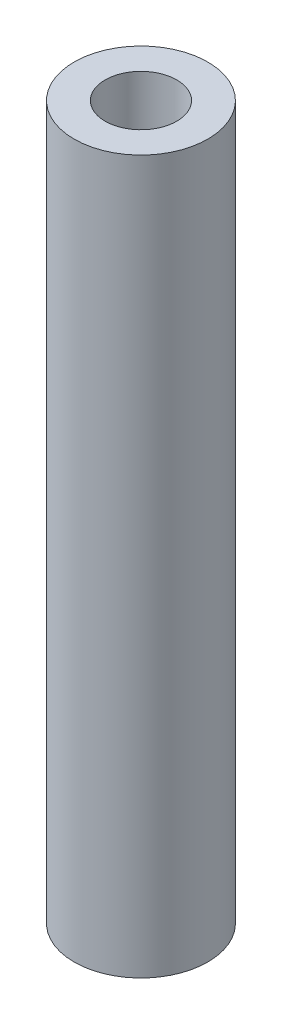
from build123d import *

# Parameters (mm, degrees)
SKETCH1_R           = 4.7625
SKETCH1_R_2         = 2.5527
BOSS_EXTRUDE1_DEPTH = 25.4


with BuildPart() as part:
    # Sketch1 → Boss-Extrude1 (new, symmetric)
    with BuildSketch(Plane(origin=(0, 0, 0), x_dir=(1, 0, 0), z_dir=(0, 1, 0))):
        with Locations(Location((0, 0, 0), (0, 0, 270))):
            Circle(SKETCH1_R)
        with Locations(Location((0, 0, 0), (0, 0, 270))):
            Circle(SKETCH1_R_2, mode=Mode.SUBTRACT)
    extrude(amount=BOSS_EXTRUDE1_DEPTH, both=True)


solid = part.part
